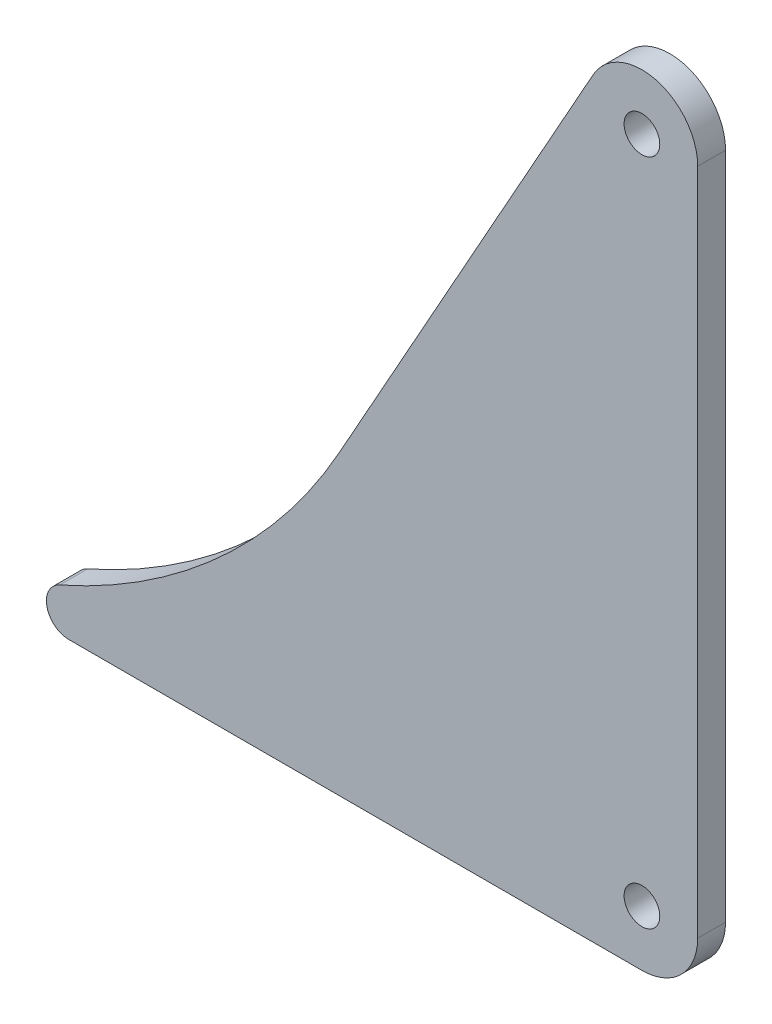
from build123d import *

# Parameters (mm, degrees)
BOSS_EXTRUDE1_DEPTH = 3.175
FILLET1_R           = 2.54
FILLET2_R           = 6.35
SKETCH2_R           = 2.032
CUT_EXTRUDE1_DEPTH  = 116.785553087


with BuildPart() as part:
    # Sketch1 → Boss-Extrude1 (new body)
    with BuildSketch(Plane.XY):
        with BuildLine():
            Line((0, 0), (0, 106.872811366))
            Line((0, 106.872811366), (-40.80699964, 33.868121814))
            ThreePointArc((-40.80699964, 33.868121814), (-60.999593642, 11.461483708), (-88.9, 0))
            Line((-88.9, 0), (0, 0))
        make_face()
    extrude(amount=BOSS_EXTRUDE1_DEPTH)

    # Fillet1
    fillet1_edges = [part.edges().sort_by_distance(p)[0] for p in [
        (-88.9, 0, 1.5875),
    ]]
    fillet(fillet1_edges, radius=FILLET1_R)

    # Fillet2
    fillet2_edges = [part.edges().sort_by_distance(p)[0] for p in [
        (0, 106.872811366, 1.5875),
        (0, 0, 1.5875),
    ]]
    fillet(fillet2_edges, radius=FILLET2_R)

    # Sketch2 → Cut-Extrude1 (cut, through all)
    with BuildSketch(Plane.XY.offset(3.175)):
        with Locations((-6.35, 6.35)):
            Circle(SKETCH2_R)
        with Locations((-6.35, 82.497944882)):
            Circle(SKETCH2_R)
    extrude(amount=-CUT_EXTRUDE1_DEPTH, mode=Mode.SUBTRACT)


solid = part.part
